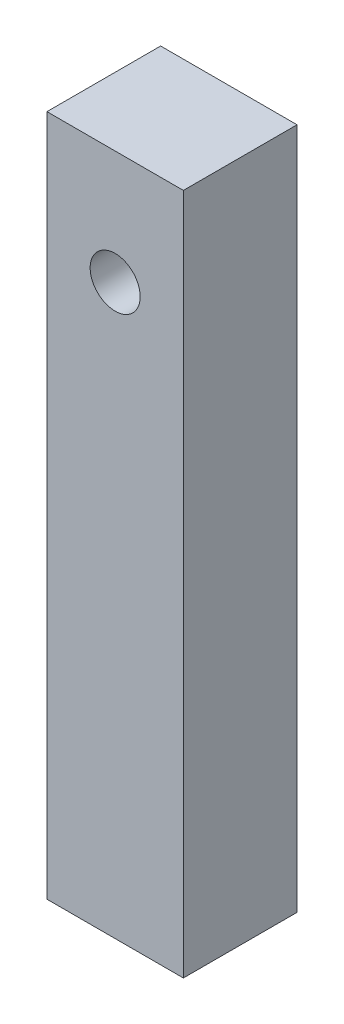
from build123d import *

# Parameters (mm, degrees)
SKETCH1_W           = 6
SKETCH1_H           = 5
BOSS_EXTRUDE1_DEPTH = 30
SKETCH2_R           = 1.1
CUT_EXTRUDE1_DEPTH  = 20


with BuildPart() as part:
    # Sketch1 → Boss-Extrude1 (new body)
    with BuildSketch(Plane(origin=(0, 0, 0), x_dir=(1, 0, 0), z_dir=(0, 1, 0))):
        with Locations((0.95450664, 1.978089534)):
            Rectangle(SKETCH1_W, SKETCH1_H)
    extrude(amount=BOSS_EXTRUDE1_DEPTH)

    # Sketch2 → Cut-Extrude1 (cut)
    with BuildSketch(Plane.XY.offset(0.521910466)):
        with Locations((0.95450664, 25)):
            Circle(SKETCH2_R)
    extrude(amount=-CUT_EXTRUDE1_DEPTH, mode=Mode.SUBTRACT)


solid = part.part
